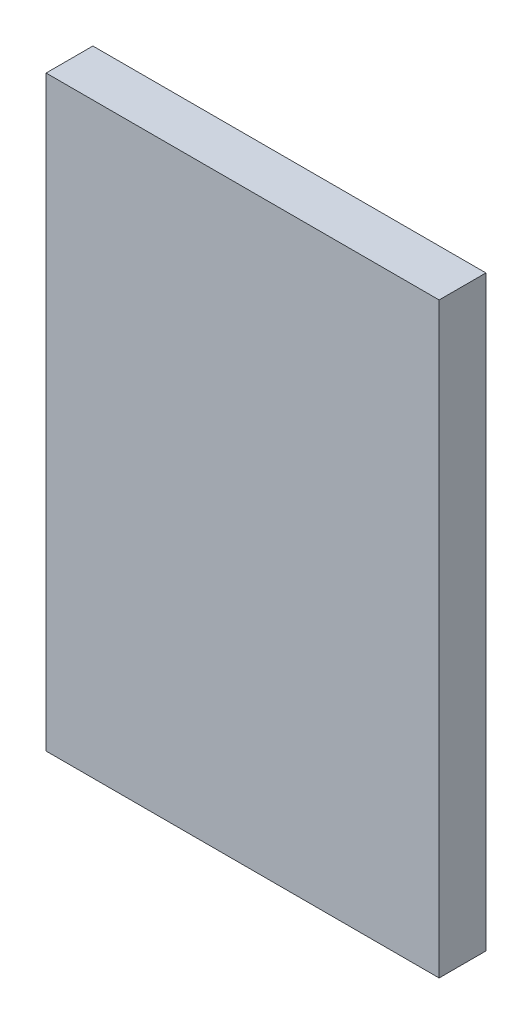
from build123d import *

# Parameters (mm, degrees)
SKETCH1_W           = 42.672
SKETCH1_H           = 63.754
BOSS_EXTRUDE1_DEPTH = 5.08


with BuildPart() as part:
    # Sketch1 → Boss-Extrude1 (new body)
    with BuildSketch(Plane.XY):
        with Locations((21.336, 31.877)):
            Rectangle(SKETCH1_W, SKETCH1_H)
    extrude(amount=BOSS_EXTRUDE1_DEPTH)


solid = part.part
